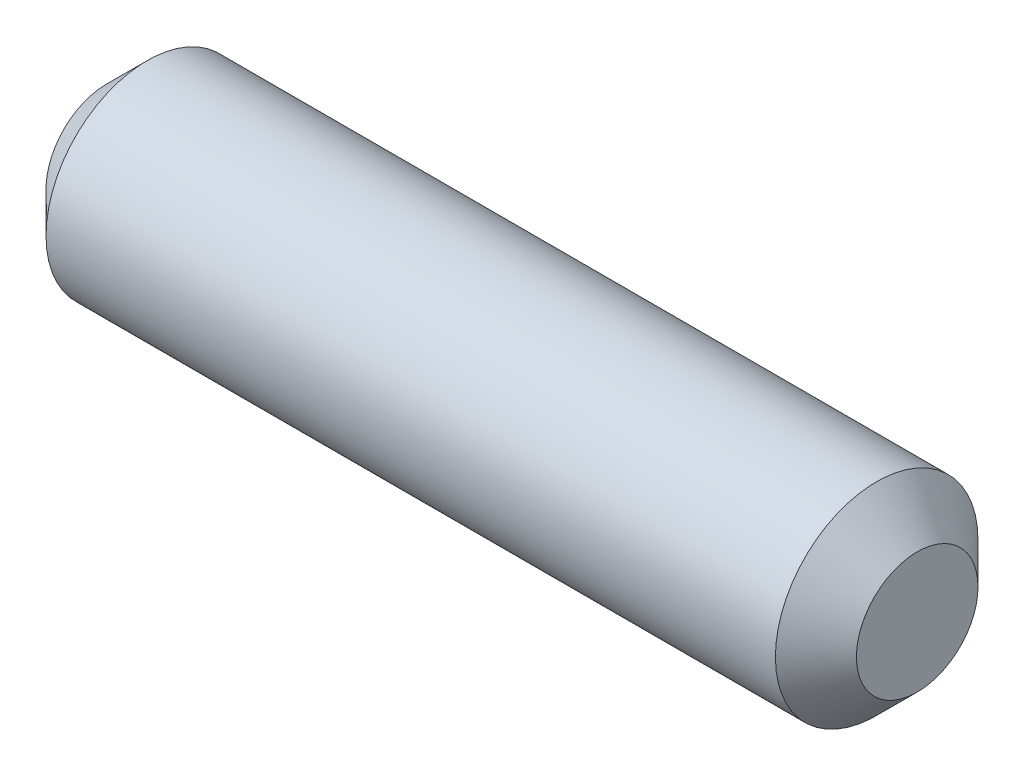
from build123d import *

# Parameters (mm, degrees)
SKETCH1_R           = 1.25
BOSS_EXTRUDE1_DEPTH = 10
CHAMFER1_SIZE       = 0.5


with BuildPart() as part:
    # Sketch1 → Boss-Extrude1 (new body)
    with BuildSketch(Plane(origin=(0, 0, 0), x_dir=(0, 0, -1), z_dir=(1, 0, 0))):
        Circle(SKETCH1_R)
    extrude(amount=BOSS_EXTRUDE1_DEPTH)

    # Chamfer1
    chamfer1_edges = [part.edges().sort_by_distance(p)[0] for p in [
        (0, 0, 1.25),
        (10, 0, 1.25),
    ]]
    chamfer(chamfer1_edges, length=CHAMFER1_SIZE)


solid = part.part
